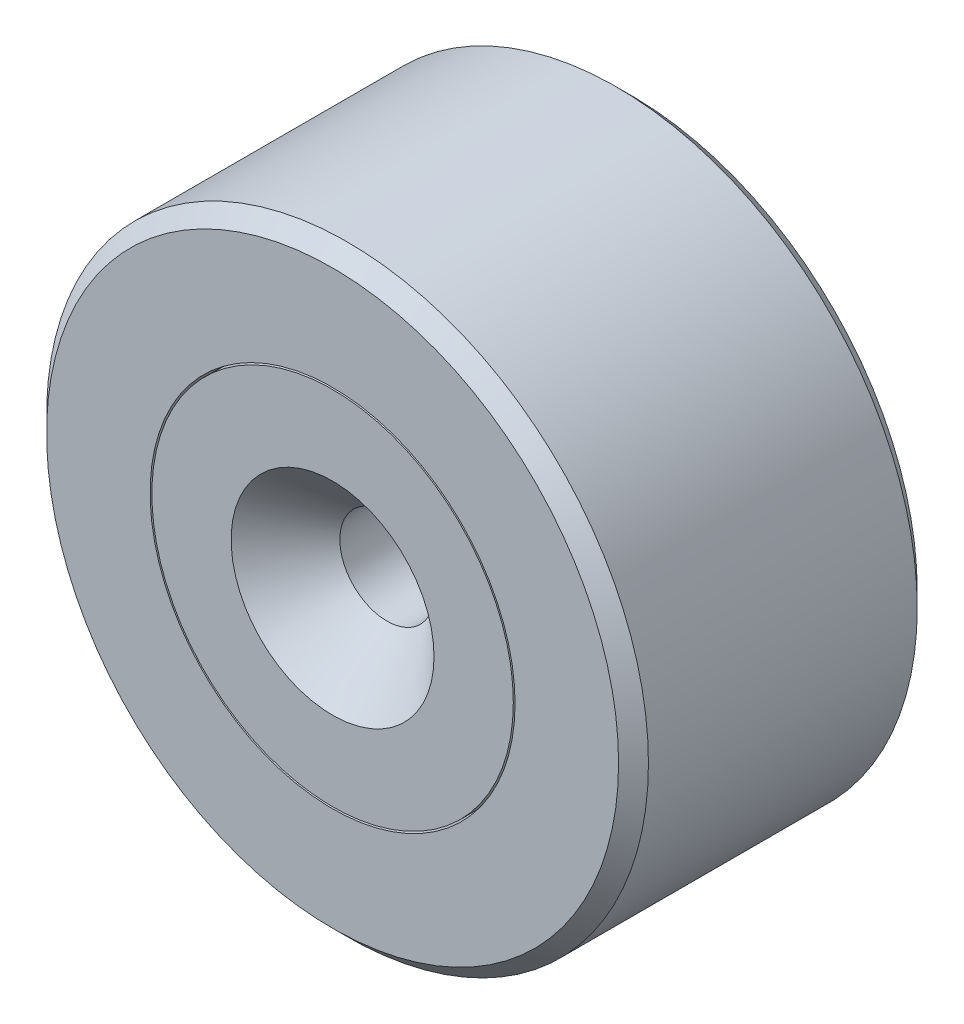
from build123d import *


with BuildPart() as part:
    # Sketch1 → Revolve1 (revolve)
    with BuildSketch(Plane(origin=(0, 0, 0), x_dir=(0, 0, -1), z_dir=(1, 0, 0))):
        with BuildLine():
            Line((3.5415, 7.93), (-3.5415, 7.93))
            Line((-3.5415, 7.93), (-3.935, 7.5365))
            Line((-3.935, 7.5365), (-3.935, 4.808552541))
            Line((-3.935, 4.808552541), (-1.953048009, 4.808552541))
            ThreePointArc((-1.953048009, 4.808552541), (0, 6.44171875), (1.953048009, 4.808552541))
            Line((1.953048009, 4.808552541), (3.935, 4.808552541))
            Line((3.935, 4.808552541), (3.935, 7.5365))
            Line((3.935, 7.5365), (3.5415, 7.93))
        make_face()
    revolve(axis=Axis((0, 0, 3.935), (0, 0, -1)))


with BuildPart() as body_2:
    # Sketch2 → Revolve2 (revolve)
    with BuildSketch(Plane(origin=(0, 0, 0), x_dir=(0, 0, -1), z_dir=(1, 0, 0))):
        with BuildLine():
            Line((-3.935, 4.106134959), (-1.953048009, 4.106134959))
            ThreePointArc((-1.953048009, 4.106134959), (-1.272952119, 2.935063538), (0, 2.47296875))
            Line((0, 2.47296875), (0.201578428, 1.240960969))
            Line((0.201578428, 1.240960969), (-2.502413005, 1.240960969))
            Line((-2.502413005, 1.240960969), (-3.935, 2.673547964))
            Line((-3.935, 2.673547964), (-3.935, 4.106134959))
        make_face()
    revolve(axis=Axis((0, 0, 3.935), (0, 0, -1)))

    # Sketch3 → Revolve3 (revolve)
    with BuildSketch(Plane(origin=(0, 0, 0), x_dir=(0, 0, -1), z_dir=(1, 0, 0))):
        with BuildLine():
            Line((-3.935, 2.673547964), (-2.502413005, 1.240960969))
            Line((-2.502413005, 1.240960969), (0, 1.240960969))
            Line((0, 1.240960969), (0, 2.47296875))
            ThreePointArc((0, 2.47296875), (1.272952119, 2.935063538), (1.953048009, 4.106134959))
            Line((1.953048009, 4.106134959), (2.672363855, 4.106134959))
            Line((2.672363855, 4.106134959), (2.672363855, 4.7625))
            Line((2.672363855, 4.7625), (-3.935, 4.7625))
            Line((-3.935, 4.7625), (-3.935, 2.673547964))
        make_face()
    revolve(axis=Axis((0, 0, 3.935), (0, 0, -1)))


solid = Compound([part.part, body_2.part])
